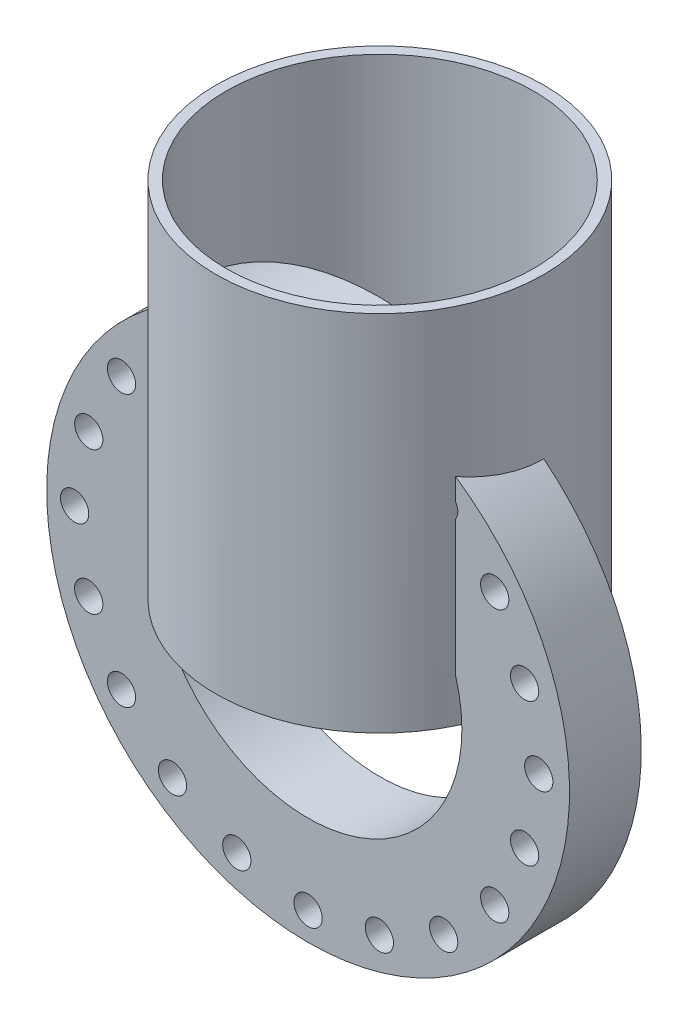
from build123d import *

# Parameters (mm, degrees)
SKETCH1_R           = 203.2
SKETCH1_R_2         = 190.5
BOSS_EXTRUDE1_DEPTH = 450
SKETCH2_R           = 323.85
SKETCH2_R_2         = 190.5
SKETCH2_R_3         = 17.5
BOSS_EXTRUDE2_DEPTH = 88.9


with BuildPart() as part:
    # Sketch1 → Boss-Extrude1 (new body)
    with BuildSketch(Plane(origin=(0, 0, 0), x_dir=(1, 0, 0), z_dir=(0, 1, 0))):
        with Locations(Location((0, 0, 0), (0, 0, 270))):
            Circle(SKETCH1_R)
        with Locations(Location((0, 0, 0), (0, 0, 270))):
            Circle(SKETCH1_R_2, mode=Mode.SUBTRACT)
    extrude(amount=BOSS_EXTRUDE1_DEPTH)

    # Sketch2 → Boss-Extrude2 (add)
    with BuildSketch(Plane.XY):
        Circle(SKETCH2_R)
        Circle(SKETCH2_R_2, mode=Mode.SUBTRACT)
        with Locations((285.75, 0)):
            Circle(SKETCH2_R_3, mode=Mode.SUBTRACT)
        with Locations((268.25, 88.301606143)):
            Circle(SKETCH2_R_3, mode=Mode.SUBTRACT)
        with Locations((231.176606143, 167.959635843)):
            Circle(SKETCH2_R_3, mode=Mode.SUBTRACT)
        with Locations(Location((167.959635843, 231.176606143, 0), (0, 0, 271.718815258))):
            Circle(SKETCH2_R_3, mode=Mode.SUBTRACT)
        with Locations((88.301606143, 271.764399531)):
            Circle(SKETCH2_R_3, mode=Mode.SUBTRACT)
        with Locations((0, 289.264399531)):
            Circle(SKETCH2_R_3, mode=Mode.SUBTRACT)
        with Locations((-88.301606143, 271.764399531)):
            Circle(SKETCH2_R_3, mode=Mode.SUBTRACT)
        with Locations(Location((-167.959635843, 231.176606143, 0), (0, 0, 91.718815258))):
            Circle(SKETCH2_R_3, mode=Mode.SUBTRACT)
        with Locations((-231.176606143, 167.959635843)):
            Circle(SKETCH2_R_3, mode=Mode.SUBTRACT)
        with Locations((-271.764399531, 88.301606143)):
            Circle(SKETCH2_R_3, mode=Mode.SUBTRACT)
        with Locations((-289.264399531, 0)):
            Circle(SKETCH2_R_3, mode=Mode.SUBTRACT)
        with Locations((-271.764399531, -88.301606143)):
            Circle(SKETCH2_R_3, mode=Mode.SUBTRACT)
        with Locations((-231.176606143, -167.959635843)):
            Circle(SKETCH2_R_3, mode=Mode.SUBTRACT)
        with Locations((-167.959635843, -231.176606143)):
            Circle(SKETCH2_R_3, mode=Mode.SUBTRACT)
        with Locations((-88.301606143, -271.764399531)):
            Circle(SKETCH2_R_3, mode=Mode.SUBTRACT)
        with Locations((0, -289.264399531)):
            Circle(SKETCH2_R_3, mode=Mode.SUBTRACT)
        with Locations((88.301606143, -271.764399531)):
            Circle(SKETCH2_R_3, mode=Mode.SUBTRACT)
        with Locations((167.959635843, -231.176606143)):
            Circle(SKETCH2_R_3, mode=Mode.SUBTRACT)
        with Locations((231.176606143, -167.959635843)):
            Circle(SKETCH2_R_3, mode=Mode.SUBTRACT)
        with Locations((268.25, -88.301606143)):
            Circle(SKETCH2_R_3, mode=Mode.SUBTRACT)
    extrude(amount=BOSS_EXTRUDE2_DEPTH)


solid = part.part
